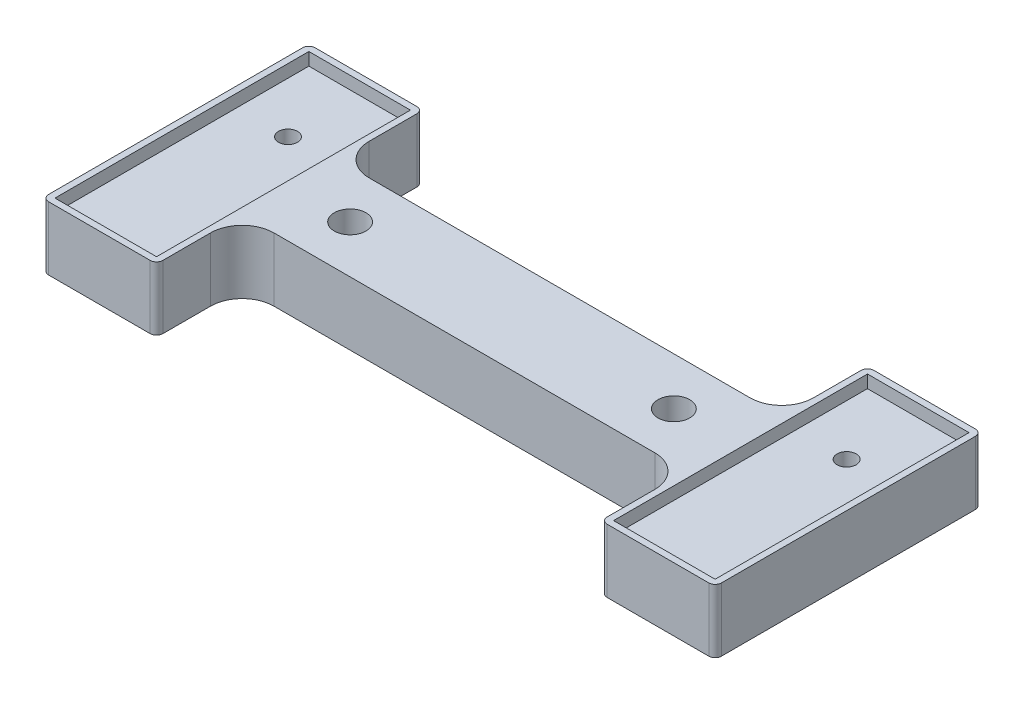
from build123d import *

# Parameters (mm, degrees)
SKETCH1_W           = 70
SKETCH1_H           = 15
SKETCH1_R           = 2.5
BOSS_EXTRUDE2_DEPTH = 10
FILLET1_R           = 5
SKETCH4_W           = 16
SKETCH4_H           = 40
CUT_EXTRUDE2_DEPTH  = 2
SKETCH5_R           = 1.5
CUT_EXTRUDE3_DEPTH  = 58.567351858
FILLET2_R           = 1


with BuildPart() as part:
    # Sketch1 → Boss-Extrude2 (new body)
    # profile 1 of 3: a face of its own
    with BuildSketch(Plane(origin=(0, 0, 0), x_dir=(1, 0, 0), z_dir=(0, 1, 0))):
        Polygon((-35, -7.5), (-35, 7.5), (-35, 21), (-53, 21), (-53, -21), (-35, -21), align=None)
    # profile 2 of 3: a face of its own
    with BuildSketch(Plane(origin=(0, 0, 0), x_dir=(1, 0, 0), z_dir=(0, 1, 0))):
        Rectangle(SKETCH1_W, SKETCH1_H)
        with Locations(Location((25.5, 0, 0), (0, 0, 270))):
            Circle(SKETCH1_R, mode=Mode.SUBTRACT)
        with Locations(Location((-25.5, 0, 0), (0, 0, 270))):
            Circle(SKETCH1_R, mode=Mode.SUBTRACT)
    # profile 3 of 3: a face of its own
    with BuildSketch(Plane(origin=(0, 0, 0), x_dir=(1, 0, 0), z_dir=(0, 1, 0))):
        Polygon((35, 21), (35, 7.5), (35, -7.5), (35, -21), (53, -21), (53, 21), align=None)
    extrude(amount=BOSS_EXTRUDE2_DEPTH)

    # Fillet1
    fillet1_edges = [part.edges().sort_by_distance(p)[0] for p in [
        (-35, 5, -7.5),
        (35, 5, -7.5),
        (35, 5, 7.5),
        (-35, 5, 7.5),
    ]]
    fillet(fillet1_edges, radius=FILLET1_R)

    # Sketch4 → Cut-Extrude2 (cut)
    with BuildSketch(Plane(origin=(0, 10, 0), x_dir=(1, 0, 0), z_dir=(0, 1, 0))):
        with Locations((-44, 0)):
            Rectangle(SKETCH4_W, SKETCH4_H)
    cut_extrude2 = extrude(amount=-CUT_EXTRUDE2_DEPTH, mode=Mode.SUBTRACT)

    # Mirror3: Cut-Extrude2 across plane
    add(cut_extrude2.mirror(Plane(origin=(0, 0, 0), x_dir=(0, 0, 1), z_dir=(1, 0, 0))), mode=Mode.SUBTRACT)

    # Sketch5 → Cut-Extrude3 (cut, symmetric)
    with BuildSketch(Plane(origin=(0, 8, 0), x_dir=(1, 0, 0), z_dir=(0, 1, 0))):
        with Locations(Location((44, 8.71, 0), (0, 0, 270))):
            Circle(SKETCH5_R)
    cut_extrude3 = extrude(amount=CUT_EXTRUDE3_DEPTH, both=True, mode=Mode.SUBTRACT)

    # Mirror4: Cut-Extrude3 across plane
    add(cut_extrude3.mirror(Plane(origin=(0, 0, 0), x_dir=(0, 0, 1), z_dir=(1, 0, 0))), mode=Mode.SUBTRACT)

    # Fillet2
    fillet2_edges = [part.edges().sort_by_distance(p)[0] for p in [
        (35, 5, -21),
        (53, 5, -21),
        (53, 5, 21),
        (35, 5, 21),
        (-35, 5, 21),
        (-53, 5, 21),
        (-53, 5, -21),
        (-35, 5, -21),
    ]]
    fillet(fillet2_edges, radius=FILLET2_R)


solid = part.part
